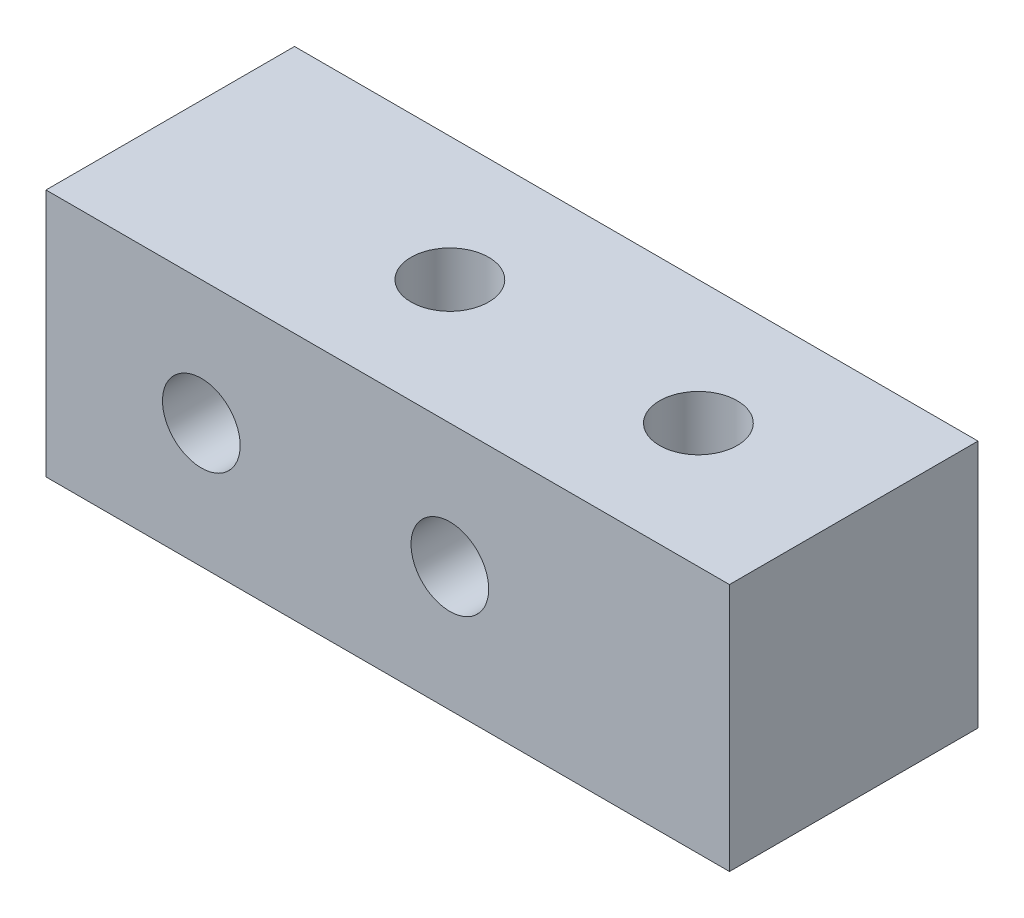
from build123d import *

# Parameters (mm, degrees)
SKETCH_2_W                   = 22
SKETCH_2_H                   = 8
EXTRUDE_1_DEPTH              = 8
HOLE_WIZARD_M3_1_D           = 2.5
HOLE_WIZARD_M3_1_ON_FACE_2_D = 2.5


with BuildPart() as part:
    # 草图2 → 凸台-拉伸1 (new body)
    with BuildSketch(Plane.XY):
        Rectangle(SKETCH_2_W, SKETCH_2_H)
    extrude(amount=EXTRUDE_1_DEPTH)

    # M3 螺纹孔的螺纹孔钻头1 (through all)
    with Locations(Plane(origin=(-2, 4, 4), x_dir=(1, 0, 0), z_dir=(0, 1, 0))):
        with Locations((0, 0), (8, 0)):
            Hole(HOLE_WIZARD_M3_1_D / 2)

    # M3 螺纹孔的螺纹孔钻头1 on face 2 (through all)
    with Locations(Plane(origin=(2, 0, 8), x_dir=(1, 0, 0), z_dir=(0, 0, 1))):
        with Locations((0, 0), (-8, 0)):
            Hole(HOLE_WIZARD_M3_1_ON_FACE_2_D / 2)


solid = part.part
